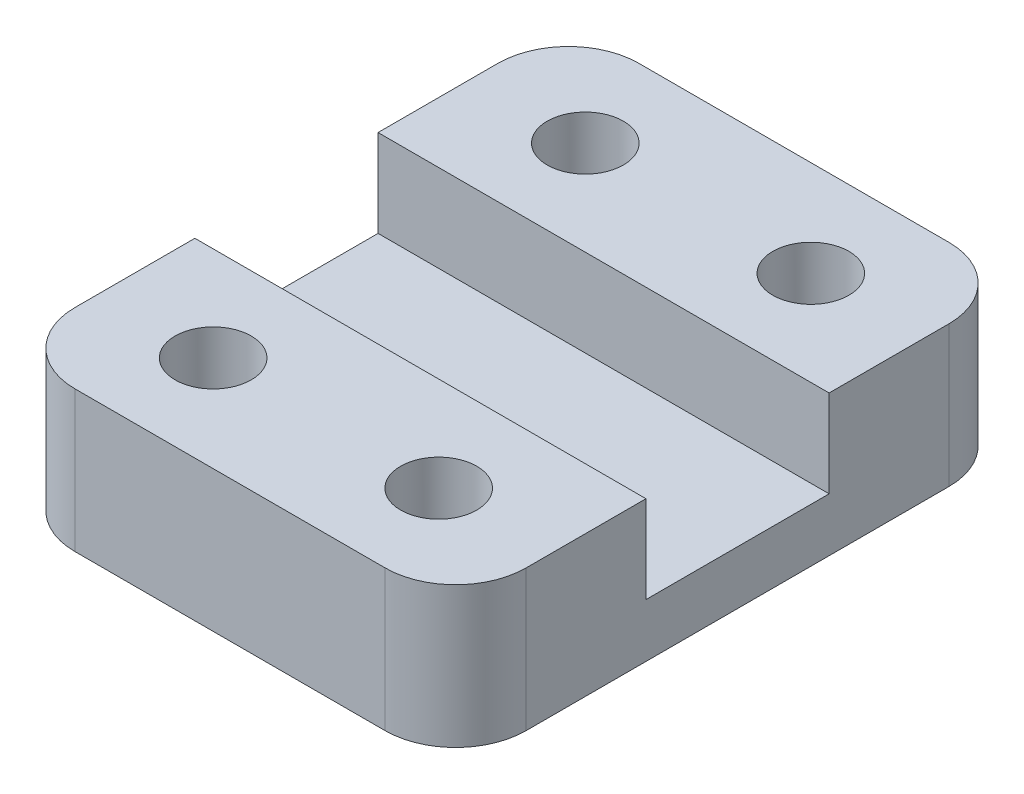
from build123d import *

# Parameters (mm, degrees)
SKETCH1_W               = 40.64
SKETCH1_H               = 50.8
BOSS_EXTRUDE1_DEPTH     = 12.7
CUT_EXTRUDE1_DEPTH      = 67.283780822
CUT_EXTRUDE1_DEPTH_BACK = 67.283780822
SKETCH3_W               = 16.502
SKETCH3_H               = 8.12
CUT_EXTRUDE2_DEPTH      = 67.283780822
CUT_EXTRUDE2_DEPTH_BACK = 67.283780822
SKETCH5_R               = 3.429
FILLET1_R               = 6.35


with BuildPart() as part:
    # Sketch1 → Boss-Extrude1 (new body)
    with BuildSketch(Plane(origin=(0, 0, 0), x_dir=(1, 0, 0), z_dir=(0, 1, 0))):
        with Locations((20.32, 25.4)):
            Rectangle(SKETCH1_W, SKETCH1_H)
    extrude(amount=BOSS_EXTRUDE1_DEPTH)

    # Sketch3 → Cut-Extrude1 (cut, two sides: drawn at the far end of the back side and taken through both)
    with BuildSketch(Plane(origin=(40.64, 0, 0), x_dir=(0, 0, -1), z_dir=(1, 0, 0)).offset(-CUT_EXTRUDE1_DEPTH_BACK)):
        with Locations((25.4, 8.89)):
            Rectangle(SKETCH3_W, SKETCH3_H)
    extrude(amount=CUT_EXTRUDE1_DEPTH + CUT_EXTRUDE1_DEPTH_BACK, mode=Mode.SUBTRACT)

    # Sketch5 → Cut-Extrude2 (cut, two sides: drawn at the far end of the back side and taken through both)
    with BuildSketch(Plane(origin=(0, 12.7, 0), x_dir=(1, 0, 0), z_dir=(0, 1, 0)).offset(-CUT_EXTRUDE2_DEPTH_BACK)):
        with Locations(Location((10.16, 8.636, 0), (0, 0, 270))):
            Circle(SKETCH5_R)
        with Locations(Location((30.48, 8.636, 0), (0, 0, 270))):
            Circle(SKETCH5_R)
        with Locations(Location((30.48, 42.164, 0), (0, 0, 270))):
            Circle(SKETCH5_R)
        with Locations(Location((10.16, 42.164, 0), (0, 0, 270))):
            Circle(SKETCH5_R)
    extrude(amount=CUT_EXTRUDE2_DEPTH + CUT_EXTRUDE2_DEPTH_BACK, mode=Mode.SUBTRACT)

    # Fillet1
    fillet1_edges = [part.edges().sort_by_distance(p)[0] for p in [
        (0, 6.35, -50.8),
        (40.64, 6.35, -50.8),
        (40.64, 6.35, 0),
        (0, 6.35, 0),
    ]]
    fillet(fillet1_edges, radius=FILLET1_R)


solid = part.part
